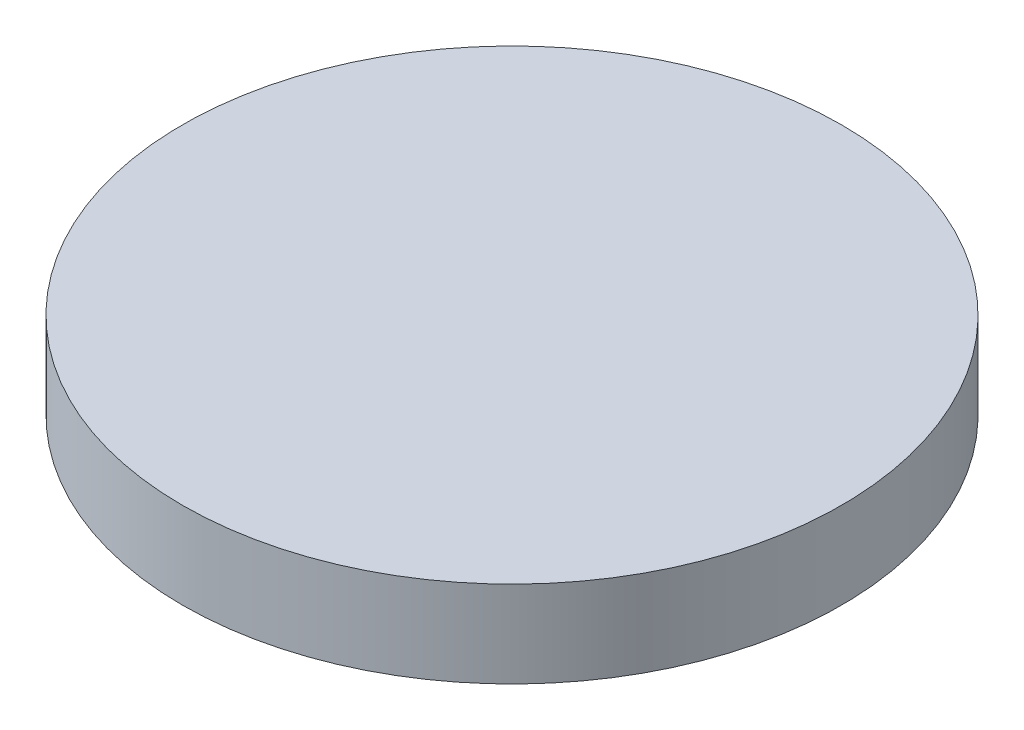
from build123d import *

# Parameters (mm, degrees)
SKETCH1_R           = 76.2
BOSS_EXTRUDE1_DEPTH = 20


with BuildPart() as part:
    # Sketch1 → Boss-Extrude1 (new body)
    with BuildSketch(Plane(origin=(0, 0, 0), x_dir=(1, 0, 0), z_dir=(0, 1, 0))):
        with Locations(Location((0, 0, 0), (0, 0, 270))):
            Circle(SKETCH1_R)
    extrude(amount=BOSS_EXTRUDE1_DEPTH)


solid = part.part
